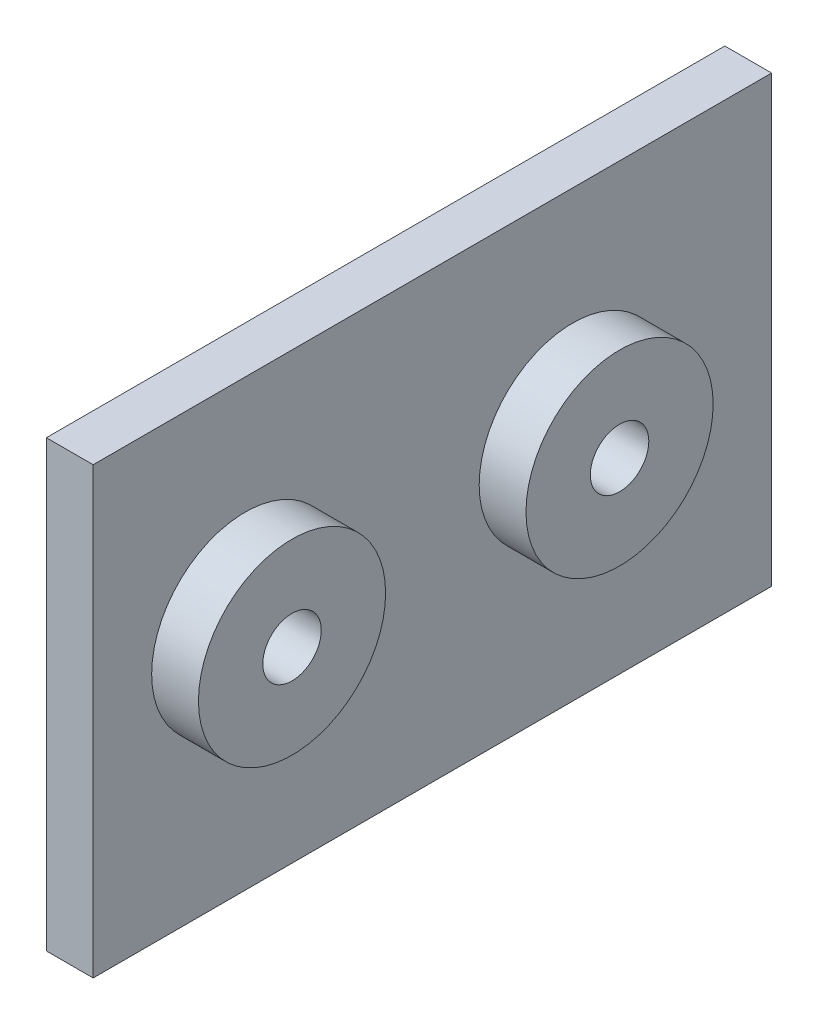
from build123d import *

# Parameters (mm, degrees)
ESBO_O1_W                = 29
ESBO_O1_H                = 19
ESBO_O1_R                = 1.25
RESSALTO_EXTRUS_O1_DEPTH = 2
ESBO_O2_R                = 4
ESBO_O2_R_2              = 1.25
RESSALTO_EXTRUS_O2_DEPTH = 2


with BuildPart() as part:
    # Esboço1 → Ressalto-extrusão1 (new body)
    with BuildSketch(Plane(origin=(0, 0, 0), x_dir=(0, 0, -1), z_dir=(1, 0, 0))):
        with Locations((2.073076923, -0.498076923)):
            Rectangle(ESBO_O1_W, ESBO_O1_H)
        with Locations((8.073076923, 0.001923077)):
            Circle(ESBO_O1_R, mode=Mode.SUBTRACT)
        with Locations((-5.926923077, 0.001923077)):
            Circle(ESBO_O1_R, mode=Mode.SUBTRACT)
    extrude(amount=RESSALTO_EXTRUS_O1_DEPTH)

    # Esboço2 → Ressalto-extrusão2 (add)
    # profile 1 of 2: a face of its own
    with BuildSketch(Plane(origin=(2, 0, 0), x_dir=(0, 0, -1), z_dir=(1, 0, 0))):
        with Locations((8.073076923, 0)):
            Circle(ESBO_O2_R)
        with Locations(Location((8.073076923, 0, 0), (0, 0, 179.955926319))):
            Circle(ESBO_O2_R_2, mode=Mode.SUBTRACT)
    # profile 2 of 2: a face of its own
    with BuildSketch(Plane(origin=(2, 0, 0), x_dir=(0, 0, -1), z_dir=(1, 0, 0))):
        with Locations((-5.926923077, 0)):
            Circle(ESBO_O2_R)
        with Locations(Location((-5.926923077, 0, 0), (0, 0, 179.955926319))):
            Circle(ESBO_O2_R_2, mode=Mode.SUBTRACT)
    extrude(amount=RESSALTO_EXTRUS_O2_DEPTH)


solid = part.part
